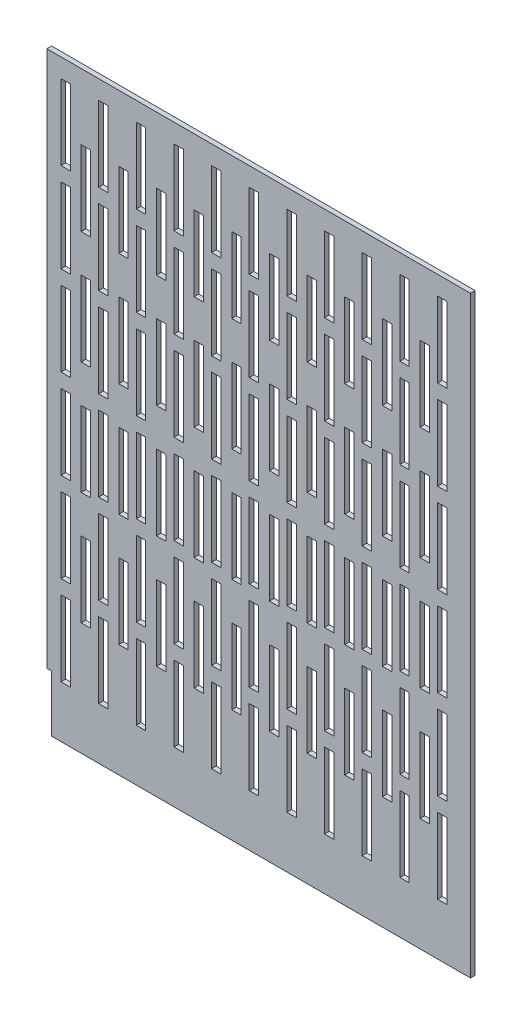
from build123d import *

# Parameters (mm, degrees)
EXTRUDE_1_DEPTH     = 0.5
SKETCH_3_W          = 1
SKETCH_3_H          = 8
CUT_EXTRUDE_1_DEPTH = 0.5


with BuildPart() as part:
    # 草图1 → 凸台-拉伸1 (new body)
    with BuildSketch(Plane.XY):
        Polygon((-45, 6), (-44.5, 6), (-44.5, 0), (0, 0), (0, 63), (-45, 63), align=None)
    extrude(amount=EXTRUDE_1_DEPTH)

    # 草图3 → 切除-拉伸1 (cut)
    with BuildSketch(Plane.XY.offset(0.5)):
        with Locations((-43, 57)):
            Rectangle(SKETCH_3_W, SKETCH_3_H)
        with Locations((-39, 57)):
            Rectangle(SKETCH_3_W, SKETCH_3_H)
        with Locations((-35, 57)):
            Rectangle(SKETCH_3_W, SKETCH_3_H)
        with Locations((-31, 57)):
            Rectangle(SKETCH_3_W, SKETCH_3_H)
        with Locations((-27, 57)):
            Rectangle(SKETCH_3_W, SKETCH_3_H)
        with Locations((-23, 57)):
            Rectangle(SKETCH_3_W, SKETCH_3_H)
        with Locations((-19, 57)):
            Rectangle(SKETCH_3_W, SKETCH_3_H)
        with Locations((-15, 57)):
            Rectangle(SKETCH_3_W, SKETCH_3_H)
        with Locations((-11, 57)):
            Rectangle(SKETCH_3_W, SKETCH_3_H)
        with Locations((-7, 57)):
            Rectangle(SKETCH_3_W, SKETCH_3_H)
        with Locations((-3, 57)):
            Rectangle(SKETCH_3_W, SKETCH_3_H)
        with Locations((-43, 47.5)):
            Rectangle(SKETCH_3_W, SKETCH_3_H)
        with Locations((-39, 47.5)):
            Rectangle(SKETCH_3_W, SKETCH_3_H)
        with Locations((-35, 47.5)):
            Rectangle(SKETCH_3_W, SKETCH_3_H)
        with Locations((-31, 47.5)):
            Rectangle(SKETCH_3_W, SKETCH_3_H)
        with Locations((-27, 47.5)):
            Rectangle(SKETCH_3_W, SKETCH_3_H)
        with Locations((-23, 47.5)):
            Rectangle(SKETCH_3_W, SKETCH_3_H)
        with Locations((-19, 47.5)):
            Rectangle(SKETCH_3_W, SKETCH_3_H)
        with Locations((-15, 47.5)):
            Rectangle(SKETCH_3_W, SKETCH_3_H)
        with Locations((-11, 47.5)):
            Rectangle(SKETCH_3_W, SKETCH_3_H)
        with Locations((-7, 47.5)):
            Rectangle(SKETCH_3_W, SKETCH_3_H)
        with Locations((-3, 47.5)):
            Rectangle(SKETCH_3_W, SKETCH_3_H)
        with Locations((-43, 38)):
            Rectangle(SKETCH_3_W, SKETCH_3_H)
        with Locations((-39, 38)):
            Rectangle(SKETCH_3_W, SKETCH_3_H)
        with Locations((-35, 38)):
            Rectangle(SKETCH_3_W, SKETCH_3_H)
        with Locations((-31, 38)):
            Rectangle(SKETCH_3_W, SKETCH_3_H)
        with Locations((-27, 38)):
            Rectangle(SKETCH_3_W, SKETCH_3_H)
        with Locations((-23, 38)):
            Rectangle(SKETCH_3_W, SKETCH_3_H)
        with Locations((-19, 38)):
            Rectangle(SKETCH_3_W, SKETCH_3_H)
        with Locations((-15, 38)):
            Rectangle(SKETCH_3_W, SKETCH_3_H)
        with Locations((-11, 38)):
            Rectangle(SKETCH_3_W, SKETCH_3_H)
        with Locations((-7, 38)):
            Rectangle(SKETCH_3_W, SKETCH_3_H)
        with Locations((-3, 38)):
            Rectangle(SKETCH_3_W, SKETCH_3_H)
        with Locations((-43, 28.5)):
            Rectangle(SKETCH_3_W, SKETCH_3_H)
        with Locations((-39, 28.5)):
            Rectangle(SKETCH_3_W, SKETCH_3_H)
        with Locations((-35, 28.5)):
            Rectangle(SKETCH_3_W, SKETCH_3_H)
        with Locations((-31, 28.5)):
            Rectangle(SKETCH_3_W, SKETCH_3_H)
        with Locations((-27, 28.5)):
            Rectangle(SKETCH_3_W, SKETCH_3_H)
        with Locations((-23, 28.5)):
            Rectangle(SKETCH_3_W, SKETCH_3_H)
        with Locations((-19, 28.5)):
            Rectangle(SKETCH_3_W, SKETCH_3_H)
        with Locations((-15, 28.5)):
            Rectangle(SKETCH_3_W, SKETCH_3_H)
        with Locations((-11, 28.5)):
            Rectangle(SKETCH_3_W, SKETCH_3_H)
        with Locations((-7, 28.5)):
            Rectangle(SKETCH_3_W, SKETCH_3_H)
        with Locations((-3, 28.5)):
            Rectangle(SKETCH_3_W, SKETCH_3_H)
        with Locations((-43, 19)):
            Rectangle(SKETCH_3_W, SKETCH_3_H)
        with Locations((-39, 19)):
            Rectangle(SKETCH_3_W, SKETCH_3_H)
        with Locations((-35, 19)):
            Rectangle(SKETCH_3_W, SKETCH_3_H)
        with Locations((-31, 19)):
            Rectangle(SKETCH_3_W, SKETCH_3_H)
        with Locations((-27, 19)):
            Rectangle(SKETCH_3_W, SKETCH_3_H)
        with Locations((-23, 19)):
            Rectangle(SKETCH_3_W, SKETCH_3_H)
        with Locations((-19, 19)):
            Rectangle(SKETCH_3_W, SKETCH_3_H)
        with Locations((-15, 19)):
            Rectangle(SKETCH_3_W, SKETCH_3_H)
        with Locations((-11, 19)):
            Rectangle(SKETCH_3_W, SKETCH_3_H)
        with Locations((-7, 19)):
            Rectangle(SKETCH_3_W, SKETCH_3_H)
        with Locations((-3, 19)):
            Rectangle(SKETCH_3_W, SKETCH_3_H)
        with Locations((-43, 9.5)):
            Rectangle(SKETCH_3_W, SKETCH_3_H)
        with Locations((-39, 9.5)):
            Rectangle(SKETCH_3_W, SKETCH_3_H)
        with Locations((-35, 9.5)):
            Rectangle(SKETCH_3_W, SKETCH_3_H)
        with Locations((-31, 9.5)):
            Rectangle(SKETCH_3_W, SKETCH_3_H)
        with Locations((-27, 9.5)):
            Rectangle(SKETCH_3_W, SKETCH_3_H)
        with Locations((-23, 9.5)):
            Rectangle(SKETCH_3_W, SKETCH_3_H)
        with Locations((-19, 9.5)):
            Rectangle(SKETCH_3_W, SKETCH_3_H)
        with Locations((-15, 9.5)):
            Rectangle(SKETCH_3_W, SKETCH_3_H)
        with Locations((-11, 9.5)):
            Rectangle(SKETCH_3_W, SKETCH_3_H)
        with Locations((-7, 9.5)):
            Rectangle(SKETCH_3_W, SKETCH_3_H)
        with Locations((-3, 9.5)):
            Rectangle(SKETCH_3_W, SKETCH_3_H)
        with Locations((-36.856472068, 52)):
            Rectangle(SKETCH_3_W, SKETCH_3_H)
        with Locations((-40.856472068, 52)):
            Rectangle(SKETCH_3_W, SKETCH_3_H)
        with Locations((-32.856472068, 52)):
            Rectangle(SKETCH_3_W, SKETCH_3_H)
        with Locations((-28.856472068, 52)):
            Rectangle(SKETCH_3_W, SKETCH_3_H)
        with Locations((-24.856472068, 52)):
            Rectangle(SKETCH_3_W, SKETCH_3_H)
        with Locations((-20.856472068, 52)):
            Rectangle(SKETCH_3_W, SKETCH_3_H)
        with Locations((-16.856472068, 52)):
            Rectangle(SKETCH_3_W, SKETCH_3_H)
        with Locations((-12.856472068, 52)):
            Rectangle(SKETCH_3_W, SKETCH_3_H)
        with Locations((-8.856472068, 52)):
            Rectangle(SKETCH_3_W, SKETCH_3_H)
        with Locations((-4.856472068, 52)):
            Rectangle(SKETCH_3_W, SKETCH_3_H)
        with Locations((-40.856472068, 40)):
            Rectangle(SKETCH_3_W, SKETCH_3_H)
        with Locations((-36.856472068, 40)):
            Rectangle(SKETCH_3_W, SKETCH_3_H)
        with Locations((-32.856472068, 40)):
            Rectangle(SKETCH_3_W, SKETCH_3_H)
        with Locations((-28.856472068, 40)):
            Rectangle(SKETCH_3_W, SKETCH_3_H)
        with Locations((-24.856472068, 40)):
            Rectangle(SKETCH_3_W, SKETCH_3_H)
        with Locations((-20.856472068, 40)):
            Rectangle(SKETCH_3_W, SKETCH_3_H)
        with Locations((-16.856472068, 40)):
            Rectangle(SKETCH_3_W, SKETCH_3_H)
        with Locations((-12.856472068, 40)):
            Rectangle(SKETCH_3_W, SKETCH_3_H)
        with Locations((-8.856472068, 40)):
            Rectangle(SKETCH_3_W, SKETCH_3_H)
        with Locations((-4.856472068, 40)):
            Rectangle(SKETCH_3_W, SKETCH_3_H)
        with Locations((-40.856472068, 28)):
            Rectangle(SKETCH_3_W, SKETCH_3_H)
        with Locations((-36.856472068, 28)):
            Rectangle(SKETCH_3_W, SKETCH_3_H)
        with Locations((-32.856472068, 28)):
            Rectangle(SKETCH_3_W, SKETCH_3_H)
        with Locations((-28.856472068, 28)):
            Rectangle(SKETCH_3_W, SKETCH_3_H)
        with Locations((-24.856472068, 28)):
            Rectangle(SKETCH_3_W, SKETCH_3_H)
        with Locations((-20.856472068, 28)):
            Rectangle(SKETCH_3_W, SKETCH_3_H)
        with Locations((-16.856472068, 28)):
            Rectangle(SKETCH_3_W, SKETCH_3_H)
        with Locations((-12.856472068, 28)):
            Rectangle(SKETCH_3_W, SKETCH_3_H)
        with Locations((-8.856472068, 28)):
            Rectangle(SKETCH_3_W, SKETCH_3_H)
        with Locations((-4.856472068, 28)):
            Rectangle(SKETCH_3_W, SKETCH_3_H)
        with Locations((-40.856472068, 16)):
            Rectangle(SKETCH_3_W, SKETCH_3_H)
        with Locations((-36.856472068, 16)):
            Rectangle(SKETCH_3_W, SKETCH_3_H)
        with Locations((-32.856472068, 16)):
            Rectangle(SKETCH_3_W, SKETCH_3_H)
        with Locations((-28.856472068, 16)):
            Rectangle(SKETCH_3_W, SKETCH_3_H)
        with Locations((-24.856472068, 16)):
            Rectangle(SKETCH_3_W, SKETCH_3_H)
        with Locations((-20.856472068, 16)):
            Rectangle(SKETCH_3_W, SKETCH_3_H)
        with Locations((-16.856472068, 16)):
            Rectangle(SKETCH_3_W, SKETCH_3_H)
        with Locations((-12.856472068, 16)):
            Rectangle(SKETCH_3_W, SKETCH_3_H)
        with Locations((-8.856472068, 16)):
            Rectangle(SKETCH_3_W, SKETCH_3_H)
        with Locations((-4.856472068, 16)):
            Rectangle(SKETCH_3_W, SKETCH_3_H)
    extrude(amount=-CUT_EXTRUDE_1_DEPTH, mode=Mode.SUBTRACT)


solid = part.part
